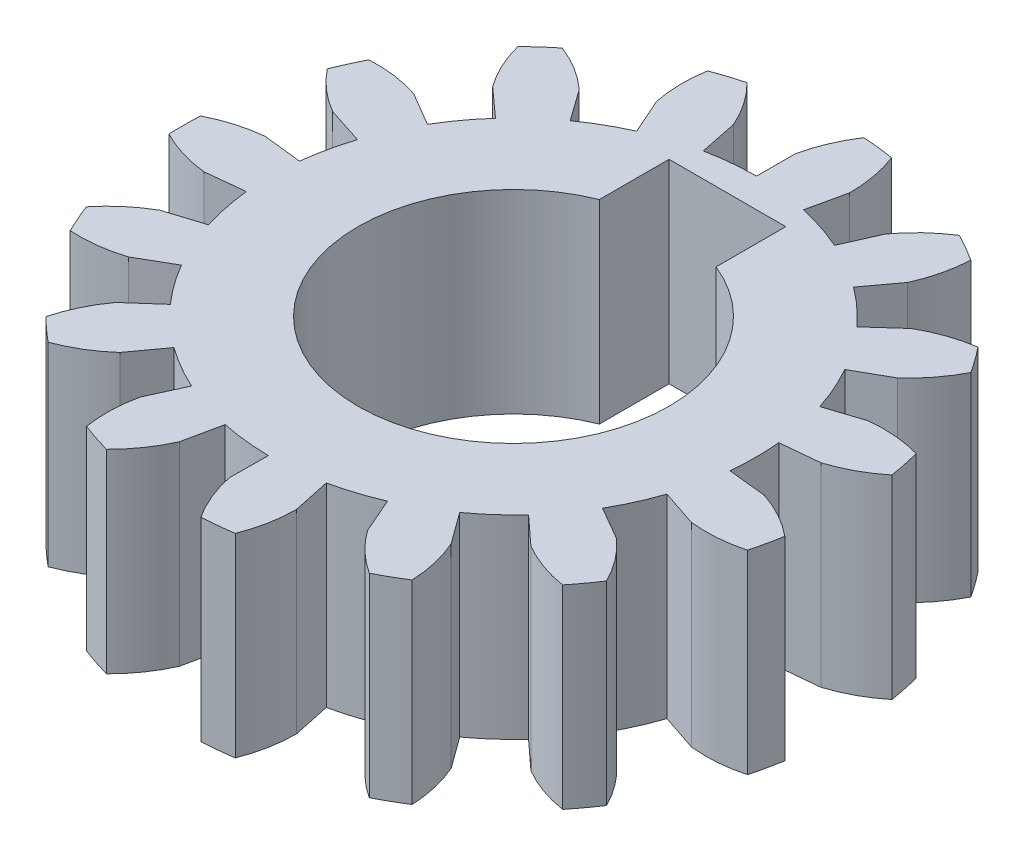
from build123d import *

# Parameters (mm, degrees)
BOSS_EXTRUDE1_DEPTH = 5
CIRPATTERN4_COUNT   = 15
SKETCH6_R           = 6.25
BOSS_EXTRUDE2_DEPTH = 5
SKETCH7_R           = 4
SKETCH7_W           = 3
SKETCH7_H           = 3
CUT_EXTRUDE1_DEPTH  = 14.011467857


with BuildPart() as part:
    # Sketch3 → Boss-Extrude1 (new body)
    with BuildSketch(Plane(origin=(0, 0, 0), x_dir=(1, 0, 0), z_dir=(0, 1, 0))):
        with BuildLine():
            Line((1.567279433, 7.07287775), (1.352139221, 6.101984884))
            ThreePointArc((1.352139221, 6.101984884), (0.680108254, 6.212886025), (0, 6.25))
            Line((0, 6.25), (0, 7.244443697))
            ThreePointArc((0, 7.244443697), (0.202974195, 7.888710473), (0.522323902, 8.483936453))
            ThreePointArc((0.522323902, 8.483936453), (0.924947225, 8.449524994), (1.325480107, 8.396017061))
            ThreePointArc((1.325480107, 8.396017061), (1.508494299, 7.745798629), (1.567279433, 7.07287775))
        make_face()
    extrude(amount=BOSS_EXTRUDE1_DEPTH)


with BuildPart() as cirpattern4_1:
    # CirPattern4: pattern copy
    add(part.part.rotate(Axis((0, 0, 0), (0, 1, 0)), 1 * 360 / CIRPATTERN4_COUNT))


with BuildPart() as cirpattern4_2:
    # CirPattern4: pattern copy
    add(part.part.rotate(Axis((0, 0, 0), (0, 1, 0)), 2 * 360 / CIRPATTERN4_COUNT))


with BuildPart() as cirpattern4_3:
    # CirPattern4: pattern copy
    add(part.part.rotate(Axis((0, 0, 0), (0, 1, 0)), 3 * 360 / CIRPATTERN4_COUNT))


with BuildPart() as cirpattern4_4:
    # CirPattern4: pattern copy
    add(part.part.rotate(Axis((0, 0, 0), (0, 1, 0)), 4 * 360 / CIRPATTERN4_COUNT))


with BuildPart() as cirpattern4_5:
    # CirPattern4: pattern copy
    add(part.part.rotate(Axis((0, 0, 0), (0, 1, 0)), 5 * 360 / CIRPATTERN4_COUNT))


with BuildPart() as cirpattern4_6:
    # CirPattern4: pattern copy
    add(part.part.rotate(Axis((0, 0, 0), (0, 1, 0)), 6 * 360 / CIRPATTERN4_COUNT))


with BuildPart() as cirpattern4_7:
    # CirPattern4: pattern copy
    add(part.part.rotate(Axis((0, 0, 0), (0, 1, 0)), 7 * 360 / CIRPATTERN4_COUNT))


with BuildPart() as cirpattern4_8:
    # CirPattern4: pattern copy
    add(part.part.rotate(Axis((0, 0, 0), (0, 1, 0)), 8 * 360 / CIRPATTERN4_COUNT))


with BuildPart() as cirpattern4_9:
    # CirPattern4: pattern copy
    add(part.part.rotate(Axis((0, 0, 0), (0, 1, 0)), 9 * 360 / CIRPATTERN4_COUNT))


with BuildPart() as cirpattern4_10:
    # CirPattern4: pattern copy
    add(part.part.rotate(Axis((0, 0, 0), (0, 1, 0)), 10 * 360 / CIRPATTERN4_COUNT))


with BuildPart() as cirpattern4_11:
    # CirPattern4: pattern copy
    add(part.part.rotate(Axis((0, 0, 0), (0, 1, 0)), 11 * 360 / CIRPATTERN4_COUNT))


with BuildPart() as cirpattern4_12:
    # CirPattern4: pattern copy
    add(part.part.rotate(Axis((0, 0, 0), (0, 1, 0)), 12 * 360 / CIRPATTERN4_COUNT))


with BuildPart() as cirpattern4_13:
    # CirPattern4: pattern copy
    add(part.part.rotate(Axis((0, 0, 0), (0, 1, 0)), 13 * 360 / CIRPATTERN4_COUNT))


with BuildPart() as cirpattern4_14:
    # CirPattern4: pattern copy
    add(part.part.rotate(Axis((0, 0, 0), (0, 1, 0)), 14 * 360 / CIRPATTERN4_COUNT))


with BuildPart() as part_1:
    add(part.part)

    add(cirpattern4_1.part)  # Boss-Extrude2 merges CirPattern4_1

    add(cirpattern4_2.part)  # Boss-Extrude2 merges CirPattern4_2

    add(cirpattern4_3.part)  # Boss-Extrude2 merges CirPattern4_3

    add(cirpattern4_4.part)  # Boss-Extrude2 merges CirPattern4_4

    add(cirpattern4_5.part)  # Boss-Extrude2 merges CirPattern4_5

    add(cirpattern4_6.part)  # Boss-Extrude2 merges CirPattern4_6

    add(cirpattern4_7.part)  # Boss-Extrude2 merges CirPattern4_7

    add(cirpattern4_8.part)  # Boss-Extrude2 merges CirPattern4_8

    add(cirpattern4_9.part)  # Boss-Extrude2 merges CirPattern4_9

    add(cirpattern4_10.part)  # Boss-Extrude2 merges CirPattern4_10

    add(cirpattern4_11.part)  # Boss-Extrude2 merges CirPattern4_11

    add(cirpattern4_12.part)  # Boss-Extrude2 merges CirPattern4_12

    add(cirpattern4_13.part)  # Boss-Extrude2 merges CirPattern4_13

    add(cirpattern4_14.part)  # Boss-Extrude2 merges CirPattern4_14
    # Sketch6 → Boss-Extrude2 (add)
    with BuildSketch(Plane(origin=(0, 0, 0), x_dir=(1, 0, 0), z_dir=(0, 1, 0))):
        Circle(SKETCH6_R)
    extrude(amount=BOSS_EXTRUDE2_DEPTH)

    # Sketch7 → Cut-Extrude1 (cut, through all)
    with BuildSketch(Plane(origin=(0, 5, 0), x_dir=(1, 0, 0), z_dir=(0, 1, 0))):
        Circle(SKETCH7_R)
        with Locations((0, 4)):
            Rectangle(SKETCH7_W, SKETCH7_H)
    extrude(amount=-CUT_EXTRUDE1_DEPTH, mode=Mode.SUBTRACT)


solid = part_1.part
